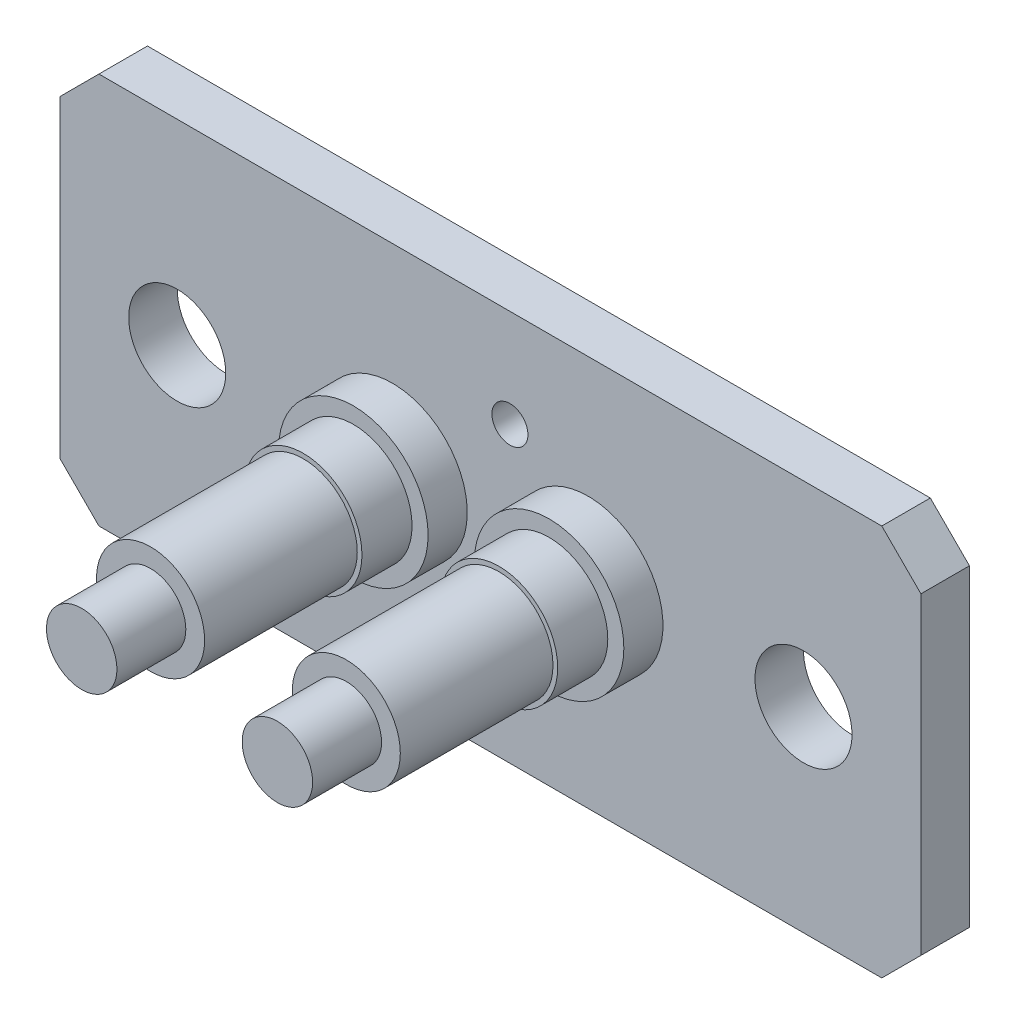
from build123d import *

# Parameters (mm, degrees)
MODEL_R             = 0.5842
MODEL_R_2           = 1.5748
BOSS_EXTRUDE1_DEPTH = 1.5748
SKETCH1_R           = 2.4257
BOSS_EXTRUDE2_DEPTH = 1.27
SKETCH2_R           = 1.905
BOSS_EXTRUDE3_DEPTH = 2.8956
SKETCH3_R           = 1.7526
BOSS_EXTRUDE4_DEPTH = 7.8486
SKETCH4_R           = 1.143
BOSS_EXTRUDE5_DEPTH = 10.0838
SKETCH5_R           = 0.508
BOSS_EXTRUDE6_DEPTH = 2.794


with BuildPart() as part:
    # Model → Boss-Extrude1 (new body)
    with BuildSketch(Plane.XY):
        Polygon((0, 11.43), (1.27, 12.7), (26.67, 12.7), (27.94, 11.43), (27.94, 1.27), (26.67, 0), (1.27, 0), (0, 1.27), align=None)
        with Locations((10.795, 6.35)):
            Circle(MODEL_R, mode=Mode.SUBTRACT)
        with Locations((17.145, 6.35)):
            Circle(MODEL_R, mode=Mode.SUBTRACT)
        with Locations((3.81, 6.35)):
            Circle(MODEL_R_2, mode=Mode.SUBTRACT)
        with Locations((24.13, 6.35)):
            Circle(MODEL_R_2, mode=Mode.SUBTRACT)
        with Locations((13.335, 3.175)):
            Circle(MODEL_R, mode=Mode.SUBTRACT)
        with Locations((14.605, 9.525)):
            Circle(MODEL_R, mode=Mode.SUBTRACT)
    extrude(amount=BOSS_EXTRUDE1_DEPTH)

    # Sketch1 → Boss-Extrude2 (add)
    with BuildSketch(Plane.XY.offset(1.5748)):
        with Locations(Location((10.795, 6.35, 0), (0, 0, 180))):
            Circle(SKETCH1_R)
        with Locations(Location((17.145, 6.35, 0), (0, 0, 180))):
            Circle(SKETCH1_R)
    extrude(amount=BOSS_EXTRUDE2_DEPTH)

    # Sketch2 → Boss-Extrude3 (add)
    with BuildSketch(Plane.XY.offset(1.5748)):
        with Locations((10.795, 6.35)):
            Circle(SKETCH2_R)
        with Locations((17.145, 6.35)):
            Circle(SKETCH2_R)
    extrude(amount=BOSS_EXTRUDE3_DEPTH)

    # Sketch3 → Boss-Extrude4 (add)
    with BuildSketch(Plane.XY.offset(1.5748)):
        with Locations((17.145, 6.35)):
            Circle(SKETCH3_R)
        with Locations((10.795, 6.35)):
            Circle(SKETCH3_R)
    extrude(amount=BOSS_EXTRUDE4_DEPTH)

    # Sketch4 → Boss-Extrude5 (add)
    with BuildSketch(Plane.XY.offset(1.5748)):
        with Locations((17.145, 6.35)):
            Circle(SKETCH4_R)
        with Locations((10.795, 6.35)):
            Circle(SKETCH4_R)
    extrude(amount=BOSS_EXTRUDE5_DEPTH)

    # Sketch5 → Boss-Extrude6 (add)
    with BuildSketch(Plane(origin=(0, 0, 1.5748), x_dir=(-1, 0, 0), z_dir=(0, 0, -1))):
        with Locations(Location((-17.145, 6.35, 0), (0, 0, 180))):
            Circle(SKETCH5_R)
        with Locations(Location((-10.795, 6.35, 0), (0, 0, 180))):
            Circle(SKETCH5_R)
    extrude(amount=BOSS_EXTRUDE6_DEPTH)


solid = part.part
